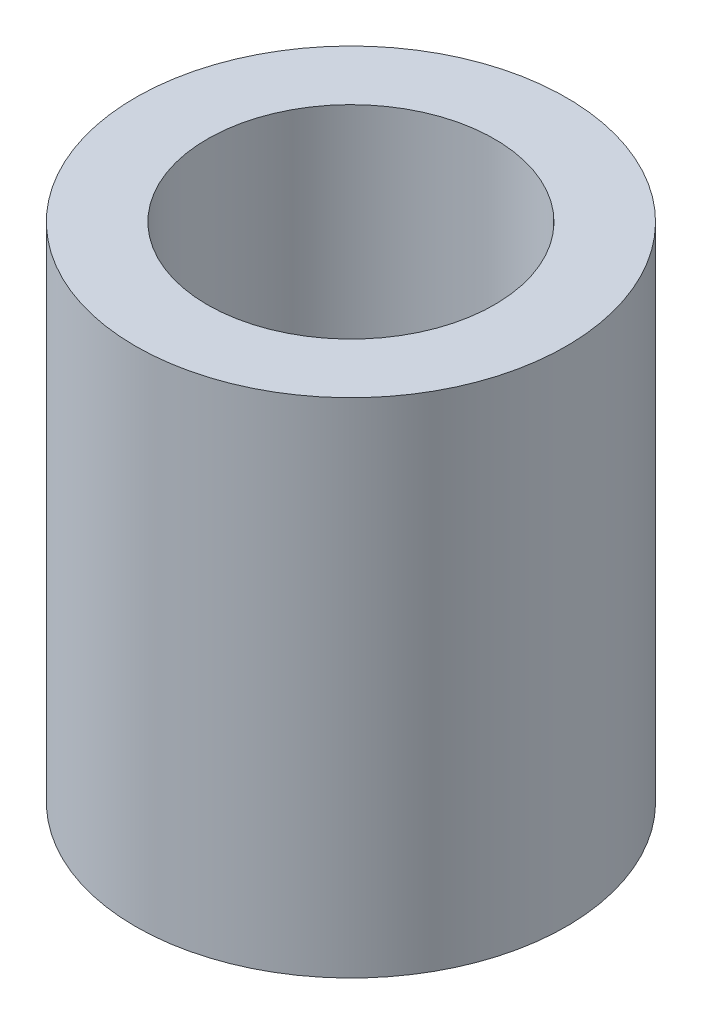
from build123d import *

# Parameters (mm, degrees)
SKETCH_1_R      = 3
SKETCH_1_R_2    = 2
EXTRUDE_1_DEPTH = 7


with BuildPart() as part:
    # Эскиз1 → Бобышка-Вытянуть1 (new body)
    with BuildSketch(Plane(origin=(0, 0, 0), x_dir=(1, 0, 0), z_dir=(0, 1, 0))):
        with Locations(Location((0, 0, 0), (0, 0, 270))):
            Circle(SKETCH_1_R)
        with Locations(Location((0, 0, 0), (0, 0, 270))):
            Circle(SKETCH_1_R_2, mode=Mode.SUBTRACT)
    extrude(amount=EXTRUDE_1_DEPTH)


solid = part.part
